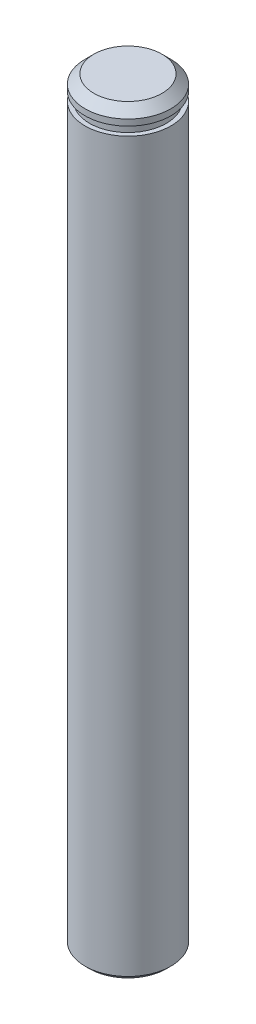
from build123d import *


with BuildPart() as part:
    # Sketch1 → Revolve1 (revolve)
    with BuildSketch(Plane.XY, mode=Mode.PRIVATE) as revolve1_sk:
        Polygon((0, 41.165), (0, -40.665), (-0.5, -41.165), (-4.825, -41.165), (-4.825, 43.835), (-1, 43.835), (0, 42.835), (0, 42.145), (-0.5, 42.145), (-0.5, 41.165), align=None)
    revolve(revolve1_sk.sketch.rotate(Axis((-4.825, 43.835, 0), (0, -1, 0)), 180), axis=Axis((-4.825, 43.835, 0), (0, -1, 0)))


solid = part.part
